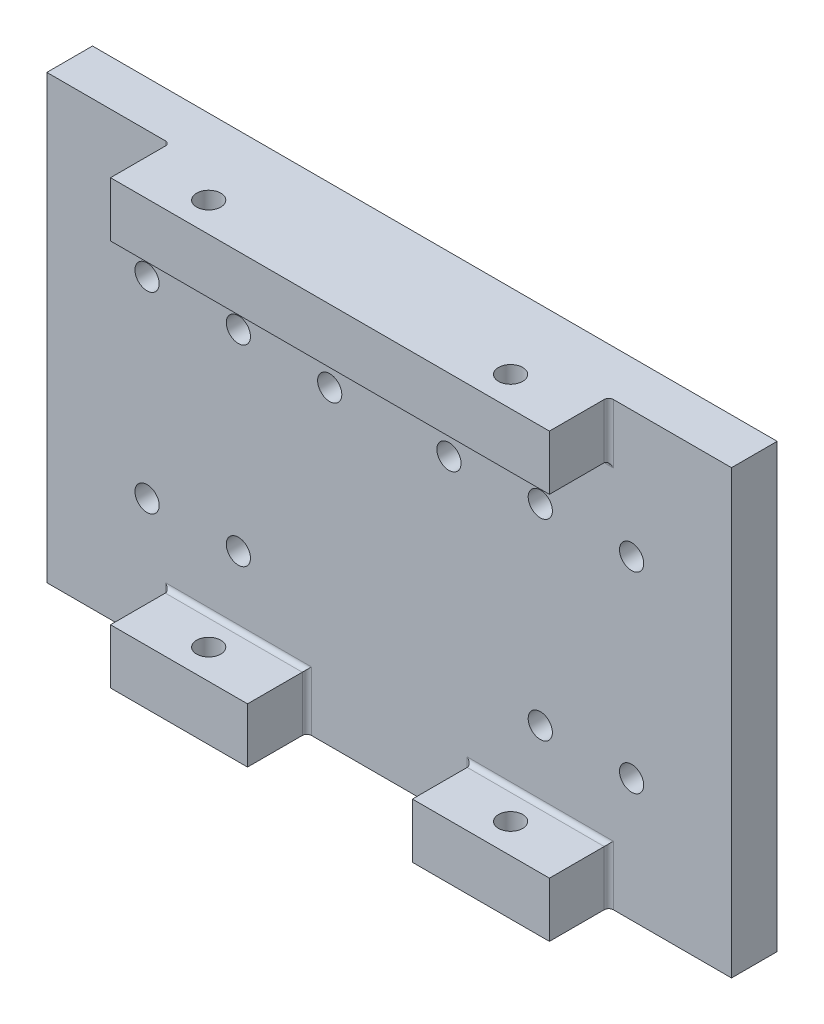
from build123d import *

# Parameters (mm, degrees)
SKETCH3_W               = 149.929020718
SKETCH3_H               = 96.78
SKETCH3_R               = 2.65
BOSS_EXTRUDE1_DEPTH     = 10
SKETCH4_W               = 30
SKETCH4_H               = 12
BOSS_EXTRUDE4_DEPTH     = 13
CUT_EXTRUDE1_DEPTH      = 116.506286536
CUT_EXTRUDE1_DEPTH_BACK = 116.506286536
SKETCH5_R               = 2.65
FILLET1_R               = 1


with BuildPart() as part:
    # Sketch3 → Boss-Extrude1 (new body)
    with BuildSketch(Plane.XY):
        with Locations((-0.035848502, 4.44)):
            Rectangle(SKETCH3_W, SKETCH3_H)
        with Locations((-53.055358861, -17.005)):
            Circle(SKETCH3_R, mode=Mode.SUBTRACT)
        with Locations((-33.055, -17.005)):
            Circle(SKETCH3_R, mode=Mode.SUBTRACT)
        with Locations((33.055, -17.005)):
            Circle(SKETCH3_R, mode=Mode.SUBTRACT)
        with Locations((53.054641139, -17.005)):
            Circle(SKETCH3_R, mode=Mode.SUBTRACT)
        with Locations((-13.055, 24.027361408)):
            Circle(SKETCH3_R, mode=Mode.SUBTRACT)
        with Locations((13.055, 24.027361408)):
            Circle(SKETCH3_R, mode=Mode.SUBTRACT)
        with Locations((-53.055358861, 25.027361408)):
            Circle(SKETCH3_R, mode=Mode.SUBTRACT)
        with Locations((-33.055, 25.027361408)):
            Circle(SKETCH3_R, mode=Mode.SUBTRACT)
        with Locations((33.055, 25.027361408)):
            Circle(SKETCH3_R, mode=Mode.SUBTRACT)
        with Locations((53.054641139, 25.027361408)):
            Circle(SKETCH3_R, mode=Mode.SUBTRACT)
    extrude(amount=BOSS_EXTRUDE1_DEPTH)

    # Sketch4 → Boss-Extrude4 (add)
    with BuildSketch(Plane.XY.offset(10)):
        with Locations((-33.055, -37.95)):
            Rectangle(SKETCH4_W, SKETCH4_H)
        Polygon((-48.055, 40.83), (-18.055, 40.83), (18.055, 40.83), (48.055, 40.83), (48.055, 52.83), (18.055, 52.83), (-18.055, 52.83), (-48.055, 52.83), align=None)
        with Locations((33.055, -37.95)):
            Rectangle(SKETCH4_W, SKETCH4_H)
    extrude(amount=BOSS_EXTRUDE4_DEPTH)

    # Sketch5 → Cut-Extrude1 (cut, two sides: drawn at the far end of the back side and taken through both)
    with BuildSketch(Plane(origin=(0, -31.95, 0), x_dir=(1, 0, 0), z_dir=(0, 1, 0)).offset(-CUT_EXTRUDE1_DEPTH_BACK)):
        with Locations(Location((33.055, -16.5, 0), (0, 0, 270))):
            Circle(SKETCH5_R)
        with Locations(Location((-33.055, -16.5, 0), (0, 0, 270))):
            Circle(SKETCH5_R)
    extrude(amount=CUT_EXTRUDE1_DEPTH + CUT_EXTRUDE1_DEPTH_BACK, mode=Mode.SUBTRACT)

    # Fillet1
    fillet1_edges = [part.edges().sort_by_distance(p)[0] for p in [
        (-48.055, 46.83, 10),
        (48.055, 46.83, 10),
        (0, 40.83, 10),
        (-18.055, -37.95, 10),
        (-33.055, -31.95, 10),
        (-48.055, -37.95, 10),
        (48.055, -37.95, 10),
        (33.055, -31.95, 10),
        (18.055, -37.95, 10),
    ]]
    fillet(fillet1_edges, radius=FILLET1_R)


solid = part.part
